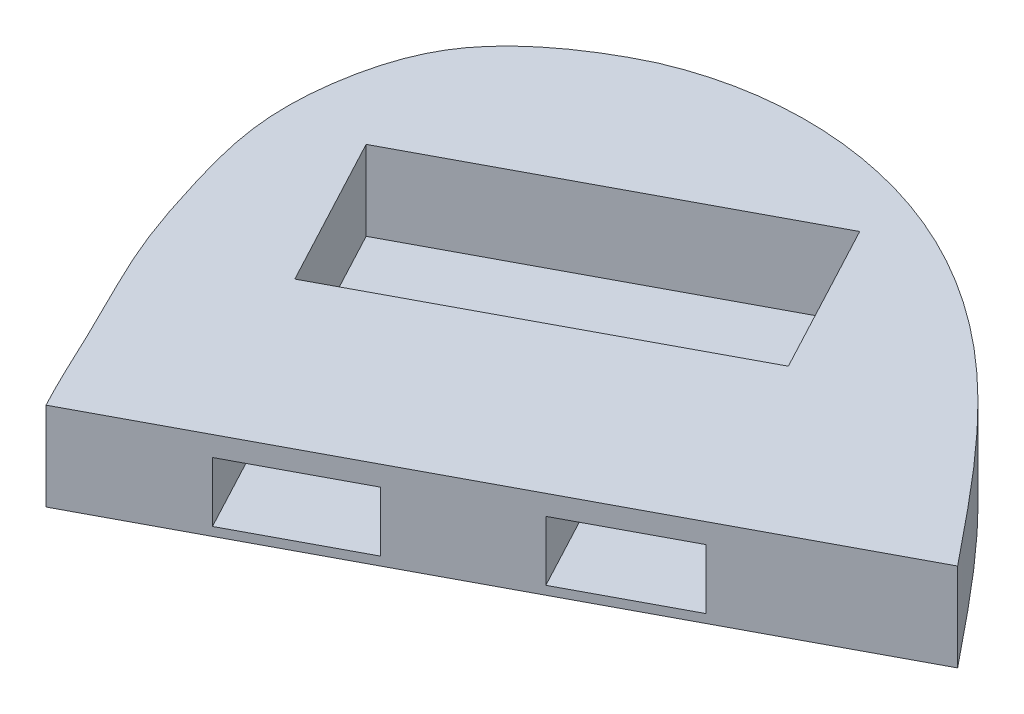
from build123d import *

# Parameters (mm, degrees)
BOSS_EXTRUDE1_DEPTH               = 1.3
BOSS_EXTRUDE2_DEPTH               = 12
CUT_TO_REMOVE_BOT_SOLE_DEPTH      = 234.592504803
CUT_TO_REMOVE_BOT_SOLE_DEPTH_BACK = 234.592504803
CUT_EXTRUDE4_REACH                = 167.31
SKETCH7_W                         = 18.70749212
SKETCH7_H                         = 9
SKETCH7_W_2                       = 17.851063772


with BuildPart() as part:
    # Sketch2 → Boss-Extrude1 (new body)
    with BuildSketch(Plane(origin=(0, 0, 0), x_dir=(1, 0, 0), z_dir=(0, 1, 0))):
        with BuildLine():
            add(Edge.make_bspline(
                [(23.05, 127), (22.943163576, 126.902857828), (6.620867571, 120.021081895), (0.931086245, 101.488970464), (0.324008086, 88.719210316), (3.825949637, 76.00589269), (8.107522159, 63.165811678), (14.622542207, 50.857319444), (20.477621735, 37.804703348), (28.027386546, 24.819252915), (38.054220669, 12.174080363), (50.087048562, -0.413905353), (63.515875121, -12.714926203), (76.995002025, -24.637109723), (87.753725412, -37.676814115), (96.95133677, -50.066381), (102.490643182, -63.337711531), (106.915198332, -76.285665463), (112.18840739, -88.815145737), (116.555805718, -101.829881852), (122.760488068, -115.656378348), (136.34325775, -130.188055829), (151.998790453, -139.029236195), (161.96, -136.1)],
                knots=[0, 0, 0, 0, 0.090945349, 0.12664197, 0.163655193, 0.201591738, 0.240816764, 0.281850131, 0.322917617, 0.365825557, 0.412648122, 0.463551179, 0.517804141, 0.571801955, 0.620389186, 0.665335117, 0.705885892, 0.745281612, 0.78501862, 0.824424381, 0.865568121, 0.915423297, 1, 1, 1, 1], degree=3))
            add(Edge.make_bspline(
                [(161.96, -136.1), (172.431616467, -132.923660625), (186.600337708, -121.715263252), (189.399120136, -101.609128058), (188.081273674, -88.738164313), (184.889467755, -75.876127028), (179.456656008, -63.289286222), (173.0414801, -50.841874911), (166.79981093, -38.270821821), (161.60365795, -25.396077846), (156.248349303, -12.794060465), (151.450238349, -0.096351247), (147.526781794, 12.914664382), (141.825873335, 25.26402088), (137.37019782, 38.220879174), (131.875071866, 50.794972902), (126.706198444, 64.316783566), (117.282300149, 76.451578571), (103.420435284, 93.759455253), (86.842392664, 113.310643183), (58.200495652, 131.153143927), (35.386261, 132.287626366), (23.05, 127)],
                knots=[0, 0, 0, 0, 0.095093522, 0.131398848, 0.167295759, 0.204174646, 0.242856644, 0.282808561, 0.322537216, 0.361360107, 0.400063589, 0.438231587, 0.476003009, 0.514706491, 0.552943744, 0.591625742, 0.630784901, 0.674461238, 0.720301597, 0.818758385, 0.889157941, 1, 1, 1, 1], degree=3))
        make_face()
    extrude(amount=-BOSS_EXTRUDE1_DEPTH)

    # Sketch3 → Boss-Extrude2 (add)
    with BuildSketch(Plane(origin=(0, 0, 0), x_dir=(1, 0, 0), z_dir=(0, 1, 0))):
        with BuildLine():
            add(Edge.make_bspline(
                [(23.05, 127), (22.943163576, 126.902857828), (6.620867571, 120.021081895), (0.931086245, 101.488970464), (0.324008086, 88.719210316), (3.825949637, 76.00589269), (8.107522159, 63.165811678), (14.622542207, 50.857319444), (18.754484417, 41.646060206), (21.253091273, 36.855386406), (21.582029576, 36.236743436)],
                knots=[0, 0, 0, 0, 0.090945349, 0.12664197, 0.163655193, 0.201591738, 0.240816764, 0.281850131, 0.322917617, 0.329035738, 0.329035738, 0.329035738, 0.329035738], degree=3))
            Line((21.582029576, 36.236743436), (111.276939854, 83.928373203))
            add(Edge.make_bspline(
                [(111.276939854, 83.928373203), (109.94087902, 85.589385686), (101.272885125, 96.292152129), (86.842392664, 113.310643183), (58.200495652, 131.153143927), (35.386261, 132.287626366), (23.05, 127)],
                knots=[0.702273444, 0.702273444, 0.702273444, 0.702273444, 0.720301597, 0.818758385, 0.889157941, 1, 1, 1, 1], degree=3))
        make_face()
        Polygon((23.877677337, 71.434462523), (11.671416705, 94.391099938), (60.233534312, 120.212035891), (72.439794944, 97.255398476), align=None, mode=Mode.SUBTRACT)
    extrude(amount=BOSS_EXTRUDE2_DEPTH)

    # Sketch6 → Cut to remove bot sole (cut, two sides: drawn at the far end of the back side and taken through both)
    with BuildSketch(Plane(origin=(0, 0, 0), x_dir=(1, 0, 0), z_dir=(0, 1, 0)).offset(-CUT_TO_REMOVE_BOT_SOLE_DEPTH_BACK)):
        with BuildLine():
            Line((111.276939854, 83.928373203), (21.582029576, 36.236743436))
            add(Edge.make_bspline(
                [(21.582029576, 36.236743436), (23.560019233, 32.51668594), (28.463593854, 24.269137433), (38.054220669, 12.174080363), (50.087048562, -0.413905353), (63.515875121, -12.714926203), (76.995002025, -24.637109723), (87.753725412, -37.676814115), (96.95133677, -50.066381), (102.490643182, -63.337711531), (106.915198332, -76.285665463), (112.18840739, -88.815145737), (116.555805718, -101.829881852), (122.760488068, -115.656378348), (136.34325775, -130.188055829), (151.998790453, -139.029236195), (161.96, -136.1)],
                knots=[0.329035738, 0.329035738, 0.329035738, 0.329035738, 0.365825557, 0.412648122, 0.463551179, 0.517804141, 0.571801955, 0.620389186, 0.665335117, 0.705885892, 0.745281612, 0.78501862, 0.824424381, 0.865568121, 0.915423297, 1, 1, 1, 1], degree=3))
            add(Edge.make_bspline(
                [(161.96, -136.1), (172.431616467, -132.923660625), (186.600337708, -121.715263252), (189.399120136, -101.609128058), (188.081273674, -88.738164313), (184.889467755, -75.876127028), (179.456656008, -63.289286222), (173.0414801, -50.841874911), (166.79981093, -38.270821821), (161.60365795, -25.396077846), (156.248349303, -12.794060465), (151.450238349, -0.096351247), (147.526781794, 12.914664382), (141.825873335, 25.26402088), (137.37019782, 38.220879174), (131.875071866, 50.794972902), (126.706198444, 64.316783566), (118.602637041, 74.751431029), (113.338093865, 81.365913132), (111.276939854, 83.928373203)],
                knots=[0, 0, 0, 0, 0.095093522, 0.131398848, 0.167295759, 0.204174646, 0.242856644, 0.282808561, 0.322537216, 0.361360107, 0.400063589, 0.438231587, 0.476003009, 0.514706491, 0.552943744, 0.591625742, 0.630784901, 0.674461238, 0.702273444, 0.702273444, 0.702273444, 0.702273444], degree=3))
        make_face()
    extrude(amount=CUT_TO_REMOVE_BOT_SOLE_DEPTH + CUT_TO_REMOVE_BOT_SOLE_DEPTH_BACK, mode=Mode.SUBTRACT)

    # Sketch7 → Cut-Extrude4 (cut, up to next)
    with BuildSketch(Plane(origin=(-10.264055011, 0, -19.3038799), x_dir=(0.8829475928589329, 0, -0.46947156278587965), z_dir=(0.46947156278587965, 0, 0.8829475928589329)), mode=Mode.PRIVATE) as cut_extrude4_sk1:
        with Locations((63.972932545, 4.5)):
            Rectangle(SKETCH7_W, SKETCH7_H)
    cut_extrude4_tool1 = extrude(cut_extrude4_sk1.sketch, amount=-CUT_EXTRUDE4_REACH, mode=Mode.PRIVATE) & part.part
    # Sketch7 → Cut-Extrude4 (cut, up to next)
    with BuildSketch(Plane(origin=(-10.264055011, 0, -19.3038799), x_dir=(0.8829475928589329, 0, -0.46947156278587965), z_dir=(0.46947156278587965, 0, 0.8829475928589329)), mode=Mode.PRIVATE) as cut_extrude4_sk2:
        with Locations((100.693654599, 4.5)):
            Rectangle(SKETCH7_W_2, SKETCH7_H)
    cut_extrude4_tool2 = extrude(cut_extrude4_sk2.sketch, amount=-CUT_EXTRUDE4_REACH, mode=Mode.PRIVATE) & part.part
    add(cut_extrude4_tool1.solids().sort_by_distance((46.220692, 4.5, -49.337353))[0], mode=Mode.SUBTRACT)
    add(cut_extrude4_tool2.solids().sort_by_distance((78.643165, 4.5, -66.576687))[0], mode=Mode.SUBTRACT)


solid = part.part
